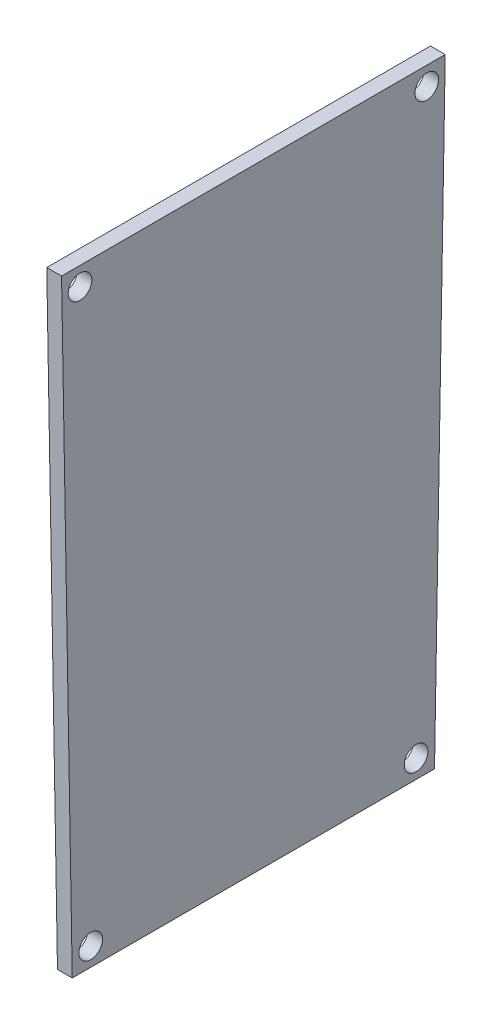
from build123d import *

# Parameters (mm, degrees)
BOSS_EXTRUDE1_DEPTH = 2
SKETCH2_R           = 1.6
CUT_EXTRUDE4_DEPTH  = 2


with BuildPart() as part:
    # Sketch1 → Boss-Extrude1 (new body)
    with BuildSketch(Plane(origin=(52.773284786, 0, 0), x_dir=(0, 0, -1), z_dir=(1, 0, 0))):
        Polygon((-92.505328732, 27.032359226), (-43.473908394, 27.032359226), (-42.025138005, 110.032359226), (-93.954099121, 110.032359226), align=None)
    extrude(amount=-BOSS_EXTRUDE1_DEPTH)

    # Sketch2 → Cut-Extrude4 (cut)
    with BuildSketch(Plane(origin=(52.773284786, 0, 0), x_dir=(0, 0, -1), z_dir=(1, 0, 0))):
        with Locations((-44.525138005, 107.532359226)):
            Circle(SKETCH2_R)
        with Locations((-91.454099121, 107.532359226)):
            Circle(SKETCH2_R)
        with Locations((-45.973908394, 29.532359226)):
            Circle(SKETCH2_R)
        with Locations((-90.005328732, 29.532359226)):
            Circle(SKETCH2_R)
    extrude(amount=-CUT_EXTRUDE4_DEPTH, mode=Mode.SUBTRACT)


solid = part.part
